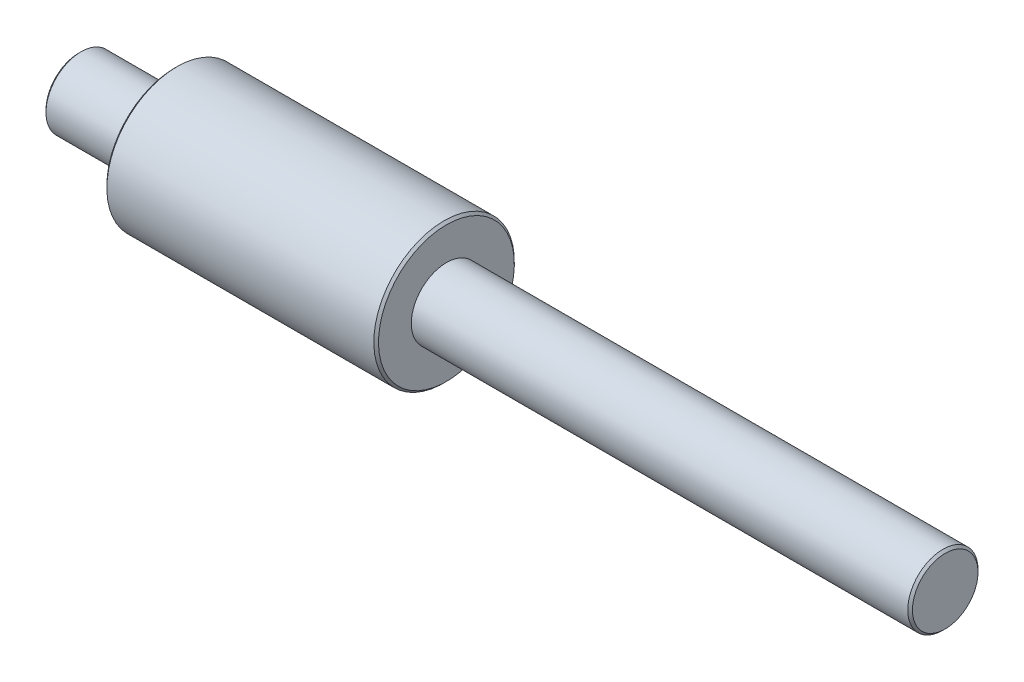
from build123d import *

# Parameters (mm, degrees)
CHAMFER3_SIZE = 0.1
CHAMFER4_SIZE = 0.1
CHAMFER5_SIZE = 0.1
CHAMFER6_SIZE = 0.1


with BuildPart() as part:
    # Sketch1 → Revolve2 (revolve)
    with BuildSketch(Plane.XY):
        Polygon((-10.65, 1.5), (0.95, 1.5), (0.95, 0), (22.25, 0), (22.25, -1.5), (0.95, -1.5), (-10.65, -1.5), (-14.75, -1.5), (-14.75, 0), (-10.65, 0), align=None)
    revolve(axis=Axis((-10.65, -1.5, 0), (-1, 0, 0)))

    # Chamfer3
    chamfer3_edges = [part.edges().sort_by_distance(p)[0] for p in [
        (-14.75, -3, 0),
    ]]
    chamfer(chamfer3_edges, length=CHAMFER3_SIZE)

    # Chamfer4
    chamfer4_edges = [part.edges().sort_by_distance(p)[0] for p in [
        (-10.65, -4.5, 0),
    ]]
    chamfer(chamfer4_edges, length=CHAMFER4_SIZE)

    # Chamfer5
    chamfer5_edges = [part.edges().sort_by_distance(p)[0] for p in [
        (0.95, -4.5, 0),
    ]]
    chamfer(chamfer5_edges, length=CHAMFER5_SIZE)

    # Chamfer6
    chamfer6_edges = [part.edges().sort_by_distance(p)[0] for p in [
        (22.25, -3, 0),
    ]]
    chamfer(chamfer6_edges, length=CHAMFER6_SIZE)


solid = part.part
